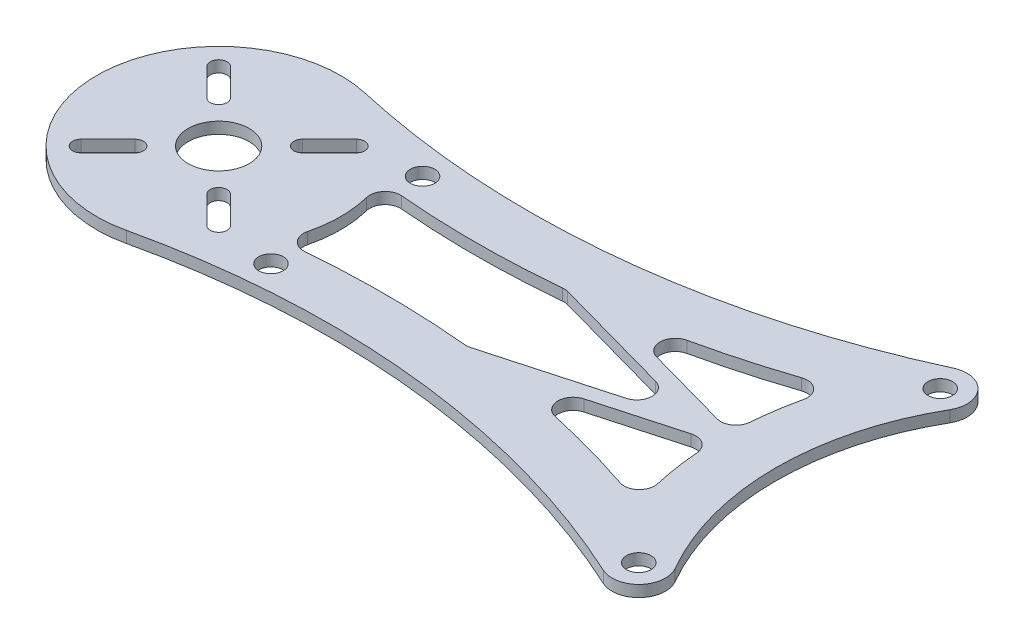
from build123d import *

# Parameters (mm, degrees)
SKETCH1_R                      = 3.5
BOSS_EXTRUDE1_DEPTH            = 0.75
F_2_2_2_2_DIAMETER_HOLE1_D     = 2.2
F_3_2_3_2_DIAMETER_HOLE1_D     = 3.2
F_3_2_3_2_DIAMETER_HOLE1_DEPTH = 10
F_3_2_3_2_DIAMETER_HOLE1_TIP   = 0.96137699
CUT_EXTRUDE1_DEPTH             = 128.152713302
FILLET1_R                      = 2
SKETCH7_R                      = 4
CUT_EXTRUDE2_DEPTH             = 128.15271342
CUT_EXTRUDE3_DEPTH             = 5


with BuildPart() as part:
    # Sketch1 → Boss-Extrude1 (new, symmetric)
    with BuildSketch(Plane(origin=(0, 0, 0), x_dir=(1, 0, 0), z_dir=(0, 1, 0))):
        with BuildLine():
            ThreePointArc((-37.239092363, -21.5), (-43, 0), (-37.239092363, 21.5))
            ThreePointArc((-37.239092363, 21.5), (-36.567343094, 22.335249783), (-35.674318722, 22.928037055))
            ThreePointArc((-35.674318722, 22.928037055), (-69.961373448, 13.496685886), (-105.45946442, 15.603352454))
            ThreePointArc((-105.45946442, 15.603352454), (-125, 0), (-105.45946442, -15.603352454))
            ThreePointArc((-105.45946442, -15.603352454), (-69.961373448, -13.496685886), (-35.674318722, -22.928037055))
            ThreePointArc((-35.674318722, -22.928037055), (-36.567343094, -22.335249783), (-37.239092363, -21.5))
        make_face()
        with BuildLine():
            ThreePointArc((-31.176914536, 18), (-35.958003449, 16.718911087), (-37.239092363, 21.5))
            ThreePointArc((-37.239092363, 21.5), (-43, 0), (-37.239092363, -21.5))
            ThreePointArc((-37.239092363, -21.5), (-35.958003449, -16.718911087), (-31.176914536, -18))
            ThreePointArc((-31.176914536, -18), (-36, 0), (-31.176914536, 18))
        make_face()
        with Locations((-34.208003449, -19.75)):
            Circle(SKETCH1_R)
        with Locations((-34.208003449, 19.75)):
            Circle(SKETCH1_R)
    extrude(amount=BOSS_EXTRUDE1_DEPTH, both=True)

    # Ø2.2 (2.2) Diameter Hole1 (through all)
    with Locations(Plane(origin=(0, 0.75, 0), x_dir=(1, 0, 0), z_dir=(0, 1, 0))):
        with Locations((-114.480077554, 5.480077554), (-103.519922446, 5.480077554), (-103.519922446, -5.480077554), (-114.480077554, -5.480077554)):
            Hole(F_2_2_2_2_DIAMETER_HOLE1_D / 2)

    # Ø3.2 (3.2) Diameter Hole1
    with Locations(Plane(origin=(0, 0.75, 0), x_dir=(1, 0, 0), z_dir=(0, 1, 0))):
        with Locations((-34.208003449, 19.75), (-34.208003449, -19.75), (-92.21668251, 9.928255337), (-92.21668251, -9.928255337)):
            Hole(F_3_2_3_2_DIAMETER_HOLE1_D / 2, depth=F_3_2_3_2_DIAMETER_HOLE1_DEPTH)
            with Locations((0, 0, -(F_3_2_3_2_DIAMETER_HOLE1_DEPTH + F_3_2_3_2_DIAMETER_HOLE1_TIP / 2))):  # 118° drill point
                Cone(0, F_3_2_3_2_DIAMETER_HOLE1_D / 2, F_3_2_3_2_DIAMETER_HOLE1_TIP, mode=Mode.SUBTRACT)

    # Sketch6 → Cut-Extrude1 (cut, through all)
    with BuildSketch(Plane(origin=(0, 0.75, 0), x_dir=(1, 0, 0), z_dir=(0, 1, 0))):
        with BuildLine():
            Line((-69.980899838, -6.458648161), (-46.735459102, 0))
            Line((-46.735459102, 0), (-69.980899838, 6.458648161))
            ThreePointArc((-69.980899838, 6.458648161), (-82.217649484, 5.904514504), (-94.444607799, 6.643836082))
            ThreePointArc((-94.444607799, 6.643836082), (-93, 0), (-94.444607799, -6.643836082))
            ThreePointArc((-94.444607799, -6.643836082), (-82.217649484, -5.904514504), (-69.980899838, -6.458648161))
        make_face()
        with BuildLine():
            Line((-64.779742297, 7.089291637), (-42.987555952, 1.03442411))
            ThreePointArc((-42.987555952, 1.03442411), (-42.397380289, 7.173712054), (-40.934970503, 13.165416435))
            ThreePointArc((-40.934970503, 13.165416435), (-52.695786799, 9.493300195), (-64.779742297, 7.089291637))
        make_face()
        with BuildLine():
            ThreePointArc((-40.934970503, -13.165416435), (-42.397380289, -7.173712054), (-42.987555952, -1.03442411))
            Line((-42.987555952, -1.03442411), (-64.779742297, -7.089291637))
            ThreePointArc((-64.779742297, -7.089291637), (-52.695786799, -9.493300195), (-40.934970503, -13.165416435))
        make_face()
    extrude(amount=-CUT_EXTRUDE1_DEPTH, mode=Mode.SUBTRACT)

    # Fillet1
    fillet1_edges = [part.edges().sort_by_distance(p)[0] for p in [
        (-42.987555952, 0, 1.03442411),
        (-40.934970503, 0, 13.165416435),
        (-64.779742297, 0, 7.089291637),
        (-94.444607799, 0, 6.643836082),
        (-94.444607799, 0, -6.643836082),
        (-69.980899838, 0, -6.458648161),
        (-46.735459102, 0, 0),
        (-69.980899838, 0, 6.458648161),
        (-40.934970503, 0, -13.165416435),
        (-42.987555952, 0, -1.03442411),
        (-64.779742297, 0, -7.089291637),
    ]]
    fillet(fillet1_edges, radius=FILLET1_R)

    # Sketch7 → Cut-Extrude2 (cut, through all)
    with BuildSketch(Plane(origin=(0, 0.75, 0), x_dir=(1, 0, 0), z_dir=(0, 1, 0))):
        with Locations(Location((-109, 0, 0), (0, 0, 270))):
            Circle(SKETCH7_R)
    extrude(amount=-CUT_EXTRUDE2_DEPTH, mode=Mode.SUBTRACT)

    # Sketch8 → Cut-Extrude3 (cut, symmetric)
    with BuildSketch(Plane(origin=(0, 0.75, 0), x_dir=(1, 0, 0), z_dir=(0, 1, 0))):
        with BuildLine():
            ThreePointArc((-99.206571081, 8.237794001), (-99.206571081, 9.793428919), (-100.762205999, 9.793428919))
            Line((-100.762205999, 9.793428919), (-104.297739905, 6.257895014))
            ThreePointArc((-104.297739905, 6.257895014), (-103.09897067, 6.49634504), (-102.419922446, 5.480077554))
            ThreePointArc((-102.419922446, 5.480077554), (-102.50365496, 5.059125779), (-102.742104986, 4.702260095))
            Line((-102.742104986, 4.702260095), (-99.206571081, 8.237794001))
        make_face()
        with BuildLine():
            ThreePointArc((-100.762205999, -9.793428919), (-99.206571081, -9.793428919), (-99.206571081, -8.237794001))
            Line((-99.206571081, -8.237794001), (-102.742104986, -4.702260095))
            ThreePointArc((-102.742104986, -4.702260095), (-102.50365496, -5.059125779), (-102.419922446, -5.480077554))
            ThreePointArc((-102.419922446, -5.480077554), (-103.09897067, -6.49634504), (-104.297739905, -6.257895014))
            Line((-104.297739905, -6.257895014), (-100.762205999, -9.793428919))
        make_face()
        with BuildLine():
            Line((-115.257895014, -4.702260095), (-118.793428919, -8.237794001))
            ThreePointArc((-118.793428919, -8.237794001), (-118.793428919, -9.793428919), (-117.237794001, -9.793428919))
            Line((-117.237794001, -9.793428919), (-113.702260095, -6.257895014))
            ThreePointArc((-113.702260095, -6.257895014), (-115.257895014, -6.257895014), (-115.257895014, -4.702260095))
        make_face()
        with BuildLine():
            Line((-113.702260095, 6.257895014), (-117.237794001, 9.793428919))
            ThreePointArc((-117.237794001, 9.793428919), (-118.793428919, 9.793428919), (-118.793428919, 8.237794001))
            Line((-118.793428919, 8.237794001), (-115.257895014, 4.702260095))
            ThreePointArc((-115.257895014, 4.702260095), (-115.257895014, 6.257895014), (-113.702260095, 6.257895014))
        make_face()
    extrude(amount=CUT_EXTRUDE3_DEPTH, both=True, mode=Mode.SUBTRACT)


solid = part.part
